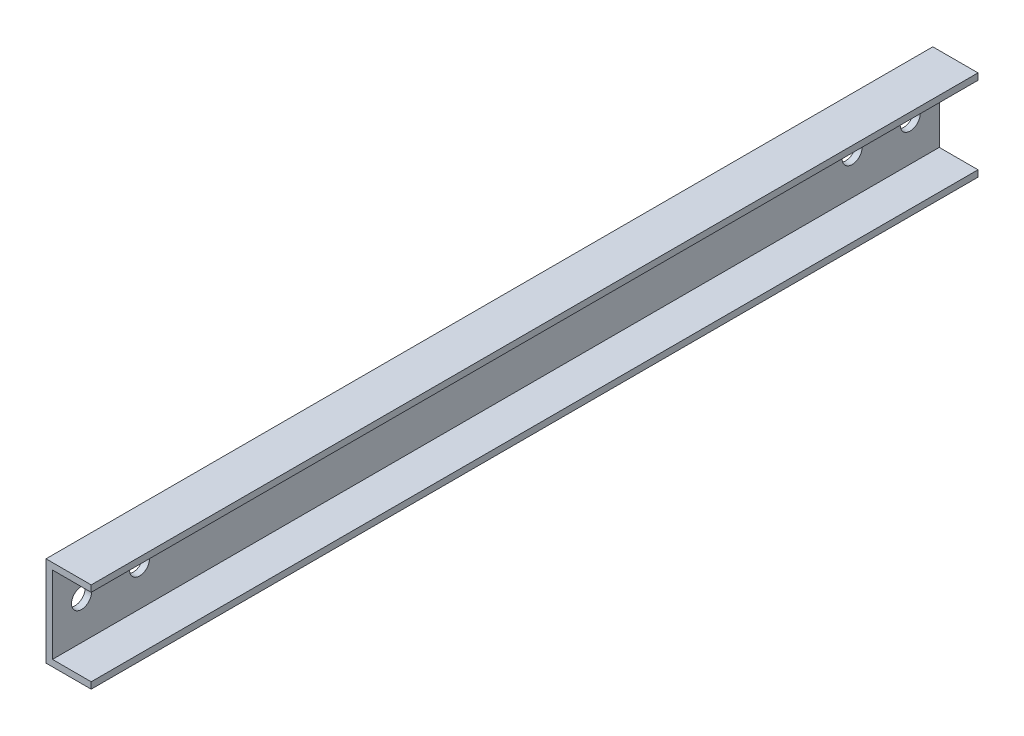
from build123d import *

# Parameters (mm, degrees)
EXTRUDE_3_DEPTH      = 1374
SKETCH_10_R          = 15.5
CUT_EXTRUDE_11_DEPTH = 1382.439828585


with BuildPart() as part:
    # 草图1 → 拉伸3 (new body)
    with BuildSketch(Plane.XY):
        Polygon((0, 0), (-60, 0), (-60, 120), (0, 120), (0, 130), (-70, 130), (-70, -10), (0, -10), align=None)
    extrude(amount=EXTRUDE_3_DEPTH)

    # 草图10 → 拉伸11 (cut, through all)
    with BuildSketch(Plane(origin=(-60, 0, 0), x_dir=(0, 0, -1), z_dir=(1, 0, 0))):
        with Locations((-45, 60)):
            Circle(SKETCH_10_R)
        with Locations((-135, 60)):
            Circle(SKETCH_10_R)
        with Locations(Location((-1239, 60, 0), (0, 0, 180))):
            Circle(SKETCH_10_R)
        with Locations(Location((-1329, 60, 0), (0, 0, 180))):
            Circle(SKETCH_10_R)
    extrude(amount=-CUT_EXTRUDE_11_DEPTH, mode=Mode.SUBTRACT)


solid = part.part
